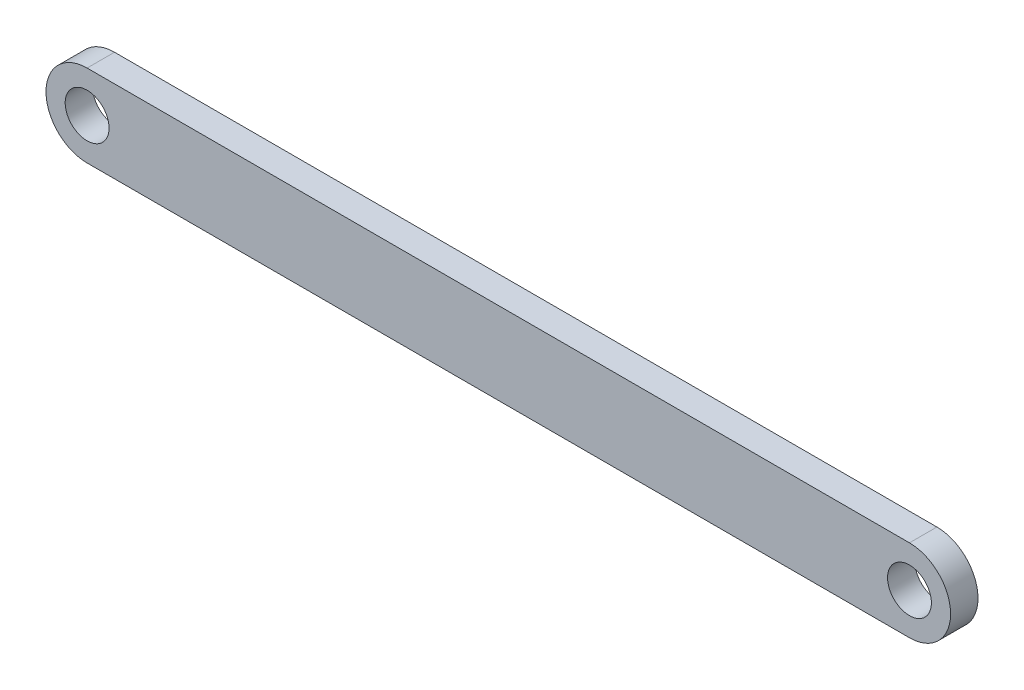
from build123d import *

# Parameters (mm, degrees)
SKETCH1_R           = 4
BOSS_EXTRUDE1_DEPTH = 2.5


with BuildPart() as part:
    # Sketch1 → Boss-Extrude1 (new, symmetric)
    with BuildSketch(Plane.XY):
        with BuildLine():
            Line((-75, 7.5), (75, 7.5))
            ThreePointArc((75, 7.5), (82.5, 0), (75, -7.5))
            Line((75, -7.5), (-75, -7.5))
            ThreePointArc((-75, -7.5), (-82.5, 0), (-75, 7.5))
        make_face()
        with Locations((75, 0)):
            Circle(SKETCH1_R, mode=Mode.SUBTRACT)
        with Locations((-75, 0)):
            Circle(SKETCH1_R, mode=Mode.SUBTRACT)
    extrude(amount=BOSS_EXTRUDE1_DEPTH, both=True)


solid = part.part
